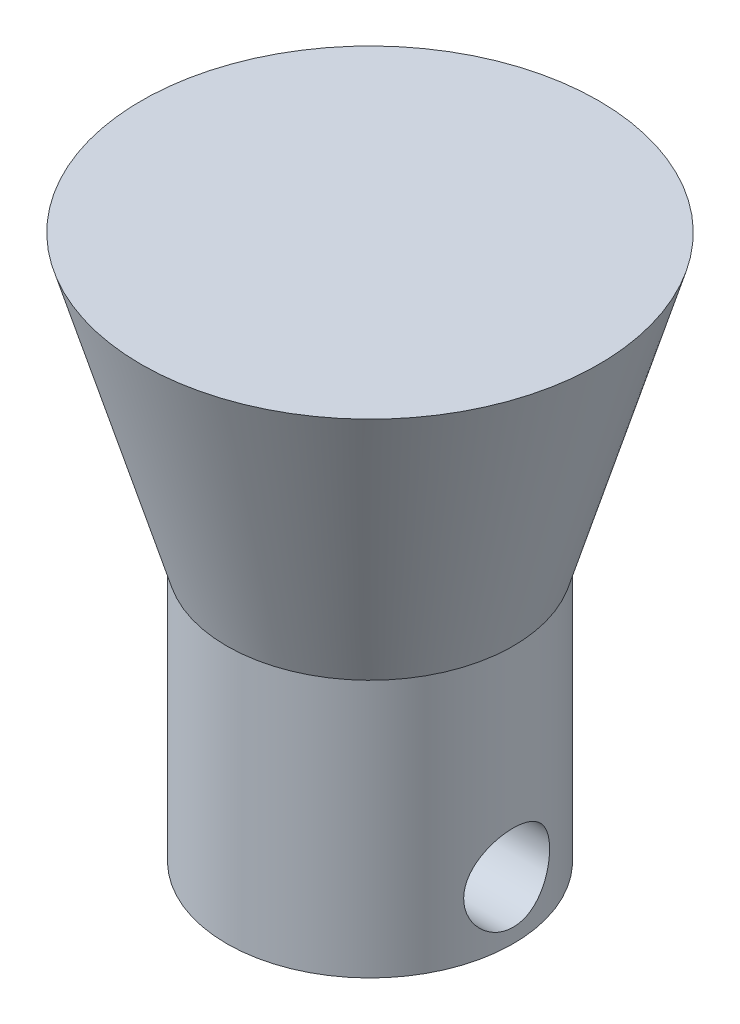
from build123d import *

# Parameters (mm, degrees)
SKETCH1_R             = 5
BODY_DEPTH            = 9
PIN_INSERT_DEPTH      = 12.445523142
PIN_INSERT_DEPTH_BACK = 12.445523142
SKETCH2_R             = 1.5
HEAD_SA_R             = 7.979


with BuildPart() as part:
    # Sketch1 → body (new body)
    with BuildSketch(Plane(origin=(0, 0, 0), x_dir=(1, 0, 0), z_dir=(0, 1, 0))):
        with Locations(Location((0, 0, 0), (0, 0, 270))):
            Circle(SKETCH1_R)
    extrude(amount=BODY_DEPTH)

    # Sketch2 → pin insert (cut, two sides: drawn at the far end of the back side and taken through both)
    with BuildSketch(Plane(origin=(0, 0, 0), x_dir=(0, 0, -1), z_dir=(1, 0, 0)).offset(-PIN_INSERT_DEPTH_BACK)):
        with Locations((0, 2)):
            Circle(SKETCH2_R)
    extrude(amount=PIN_INSERT_DEPTH + PIN_INSERT_DEPTH_BACK, mode=Mode.SUBTRACT)

    # head SA → section 0 of cone
    with BuildSketch(Plane(origin=(0, 19, 0), x_dir=(1, 0, 0), z_dir=(0, 1, 0)), mode=Mode.PRIVATE) as cone_s0:
        Circle(HEAD_SA_R)
    # loft up to a face of the part (cone)
    loft([cone_s0.sketch, part.faces().sort_by_distance((0, 9, 0))[0]])


solid = part.part
